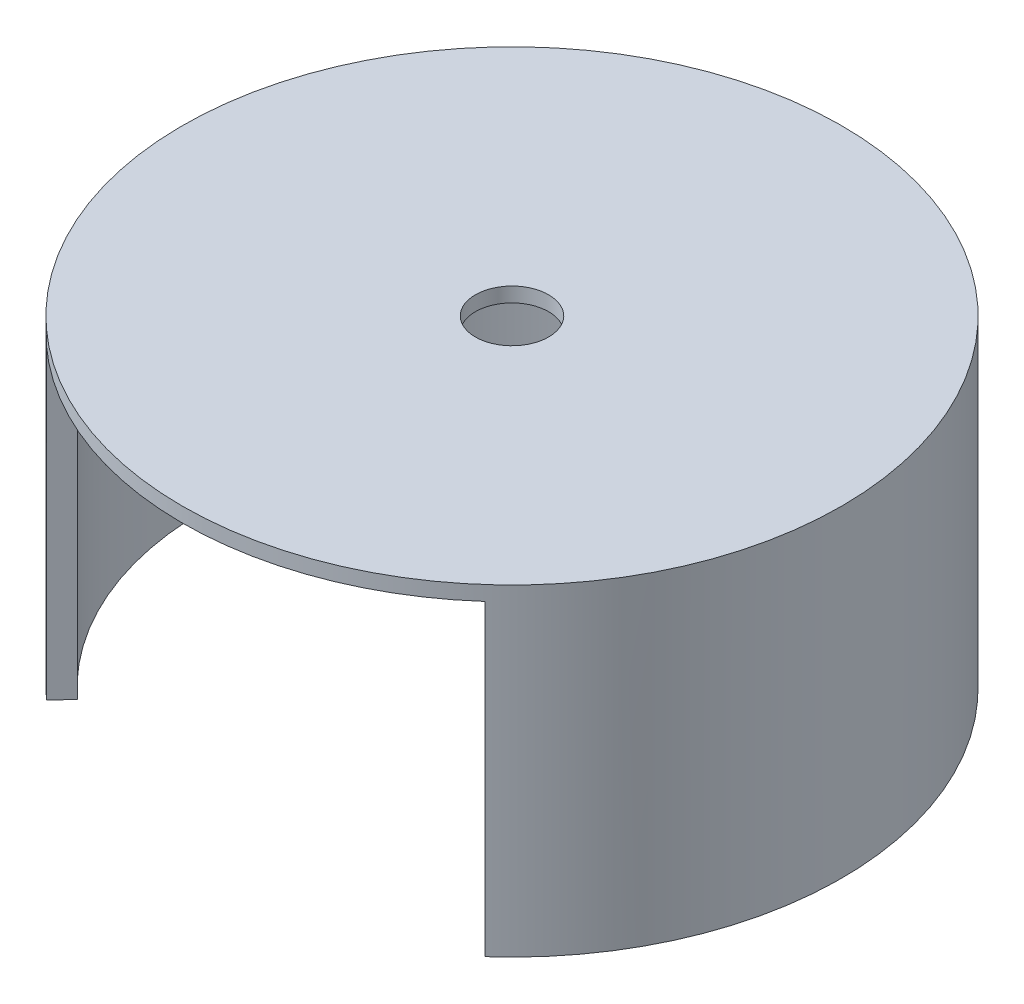
from build123d import *

# Parameters (mm, degrees)
AUFSATZ_LINEAR_AUSTRAGEN1_DEPTH = 44
AUFSATZ_LINEAR_START            = -2
SKIZZE2_R                       = 45
SKIZZE2_R_2                     = 5
AUFSATZ_LINEAR_AUSTRAGEN2_DEPTH = 2
SKIZZE3_R                       = 8
SCHNITT_LINEAR_AUSTRAGEN2_DEPTH = 9.26
AUFSATZ_LINEAR_AUSTRAGEN3_DEPTH = 4
KREISMUSTER1_COUNT              = 3
KREISMUSTER1_ANGLE              = 180


with BuildPart() as part:
    # Skizze1 → Aufsatz-Linear austragen1 (new body)
    with BuildSketch(Plane(origin=(0, 0, 0), x_dir=(1, 0, 0), z_dir=(0, 1, 0))):
        with BuildLine():
            Line((28.22984402, -31.097844083), (29.932068323, -33.601655999))
            ThreePointArc((29.932068323, -33.601655999), (0.280437371, 44.999126157), (-30.348542355, -33.225983461))
            Line((-30.348542355, -33.225983461), (-28.325306198, -31.010917897))
            ThreePointArc((-28.325306198, -31.010917897), (0.064554608, 41.999950389), (28.22984402, -31.097844083))
        make_face()
    extrude(amount=AUFSATZ_LINEAR_AUSTRAGEN1_DEPTH)

    # Skizze2 → Aufsatz-Linear austragen2 (add)
    with BuildSketch(Plane(origin=(0, 44, 0), x_dir=(1, 0, 0), z_dir=(0, 1, 0)).offset(AUFSATZ_LINEAR_START)):
        with Locations(Location((0, 0, 0), (0, 0, 227.591490679))):
            Circle(SKIZZE2_R)
        with Locations(Location((0, 0, 0), (0, 0, 270))):
            Circle(SKIZZE2_R_2, mode=Mode.SUBTRACT)
    extrude(amount=AUFSATZ_LINEAR_AUSTRAGEN2_DEPTH)

    # Skizze3 → Schnitt-Linear austragen2 (cut)
    with BuildSketch(Plane(origin=(0, 0, -45), x_dir=(-1, 0, 0), z_dir=(0, 0, -1))):
        with Locations((0, 11.392175051)):
            Circle(SKIZZE3_R)
    extrude(amount=-SCHNITT_LINEAR_AUSTRAGEN2_DEPTH, mode=Mode.SUBTRACT)

    # Skizze4 → Aufsatz-Linear austragen3 (add, symmetric)
    with BuildSketch(Plane.XY):
        with BuildLine():
            Line((-41.880766109, 42), (-41.880766109, 19.345066602))
            add(Edge.make_bspline(
                [(-41.880766109, 19.345066602), (-37.634088063, 37.128030919), (-19.638651498, 42)],
                knots=[0, 0, 0, 1, 1, 1], degree=2))
            Line((-19.638651498, 42), (-41.880766109, 42))
        make_face()
    aufsatz_linear_austragen3 = extrude(amount=AUFSATZ_LINEAR_AUSTRAGEN3_DEPTH, both=True)

    # Kreismuster1: Aufsatz-Linear austragen3 ×3 about axis
    kreismuster1_axis = Axis((0, 42, 0), (0, -1, 0))
    for i in range(1, KREISMUSTER1_COUNT):
        add(aufsatz_linear_austragen3.rotate(kreismuster1_axis, i * KREISMUSTER1_ANGLE / (KREISMUSTER1_COUNT - 1)))


solid = part.part
